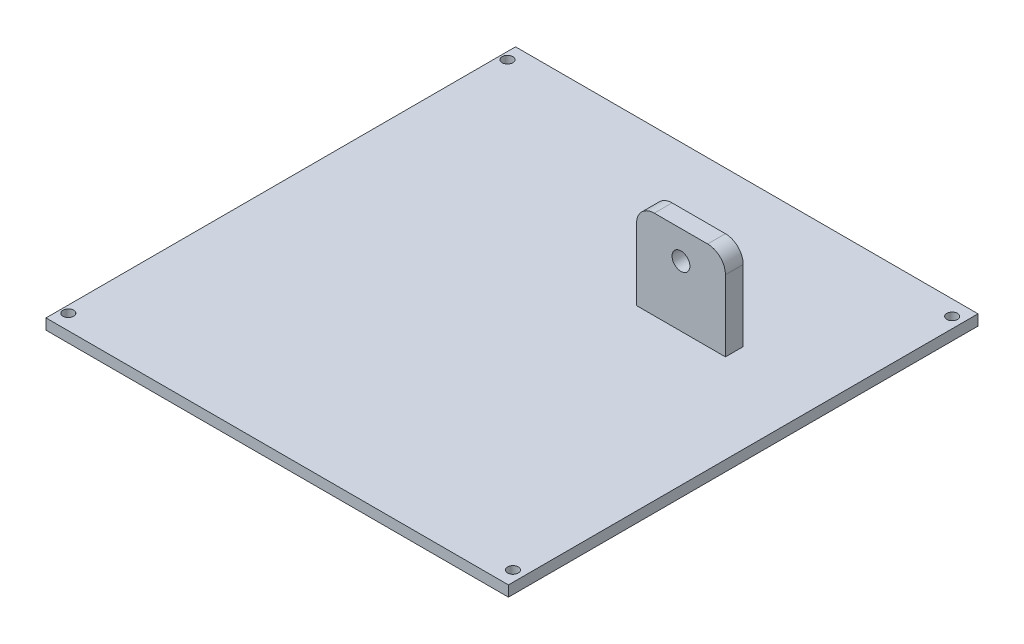
from build123d import *

# Parameters (mm, degrees)
SKETCH1_W           = 130
SKETCH1_H           = 132
BOSS_EXTRUDE1_DEPTH = 3
SKETCH2_W           = 25
SKETCH2_H           = 5
BOSS_EXTRUDE2_DEPTH = 25
FILLET1_R           = 5
SKETCH3_R           = 2.5
CUT_EXTRUDE1_DEPTH  = 25
SKETCH4_R           = 1.5
CUT_EXTRUDE2_DEPTH  = 25


with BuildPart() as part:
    # Sketch1 → Boss-Extrude1 (new body)
    with BuildSketch(Plane(origin=(0, 0, 0), x_dir=(1, 0, 0), z_dir=(0, 1, 0))):
        Rectangle(SKETCH1_W, SKETCH1_H)
    extrude(amount=BOSS_EXTRUDE1_DEPTH)

    # Sketch2 → Boss-Extrude2 (add)
    with BuildSketch(Plane(origin=(0, 3, 0), x_dir=(1, 0, 0), z_dir=(0, 1, 0))):
        with Locations((27.5, 22.5)):
            Rectangle(SKETCH2_W, SKETCH2_H)
    extrude(amount=BOSS_EXTRUDE2_DEPTH)

    # Fillet1
    fillet1_edges = [part.edges().sort_by_distance(p)[0] for p in [
        (15, 28, -22.5),
        (40, 28, -22.5),
    ]]
    fillet(fillet1_edges, radius=FILLET1_R)

    # Sketch3 → Cut-Extrude1 (cut)
    with BuildSketch(Plane.XY.offset(-20)):
        with Locations((27.5, 20.0647296)):
            Circle(SKETCH3_R)
    extrude(amount=-CUT_EXTRUDE1_DEPTH, mode=Mode.SUBTRACT)

    # Sketch4 → Cut-Extrude2 (cut)
    with BuildSketch(Plane(origin=(0, 3, 0), x_dir=(1, 0, 0), z_dir=(0, 1, 0))):
        with Locations(Location((-63, 61.73, 0), (0, 0, 270))):
            Circle(SKETCH4_R)
        with Locations(Location((62, 61.73, 0), (0, 0, 270))):
            Circle(SKETCH4_R)
        with Locations(Location((-63, -61.73, 0), (0, 0, 270))):
            Circle(SKETCH4_R)
        with Locations(Location((62, -61.73, 0), (0, 0, 270))):
            Circle(SKETCH4_R)
    extrude(amount=-CUT_EXTRUDE2_DEPTH, mode=Mode.SUBTRACT)


solid = part.part
